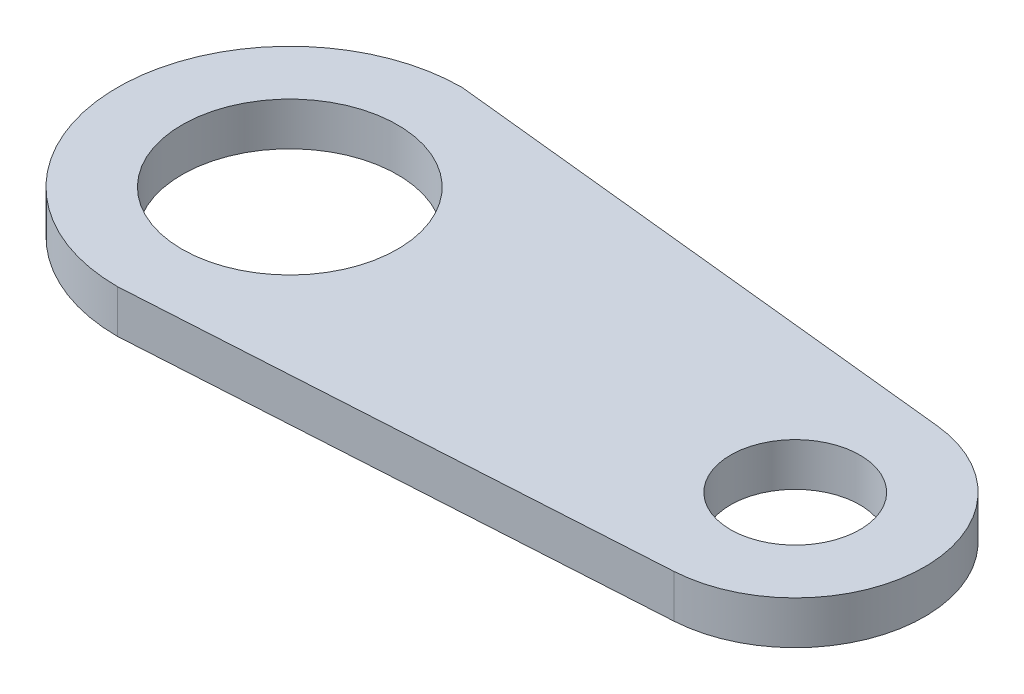
from build123d import *

# Parameters (mm, degrees)
BOSS_EXTRUDE1_DEPTH = 5
SKETCH2_R           = 12.5
SKETCH2_R_2         = 7.5
CUT_EXTRUDE1_DEPTH  = 10


with BuildPart() as part:
    # Sketch1 → Boss-Extrude1 (new body)
    with BuildSketch(Plane(origin=(0, 0, 0), x_dir=(1, 0, 0), z_dir=(0, 1, 0))):
        with BuildLine():
            Line((61.545103008, 13.562628278), (0, 20))
            ThreePointArc((0, 20), (-20, 0), (0, -20))
            Line((0, -20), (2.403061157, -19.855107582))
            Line((2.403061157, -19.855107582), (60.887460049, -16.328794499))
            ThreePointArc((60.887460049, -16.328794499), (74.981046517, -1.685922519), (61.545103008, 13.562628278))
        make_face()
    extrude(amount=BOSS_EXTRUDE1_DEPTH)

    # Sketch2 → Cut-Extrude1 (cut)
    with BuildSketch(Plane(origin=(0, 5, 0), x_dir=(1, 0, 0), z_dir=(0, 1, 0))):
        with Locations(Location((0, 0, 0), (0, 0, 270))):
            Circle(SKETCH2_R)
        with Locations(Location((59.984675549, -1.355986475, 0), (0, 0, 270))):
            Circle(SKETCH2_R_2)
    extrude(amount=-CUT_EXTRUDE1_DEPTH, mode=Mode.SUBTRACT)


solid = part.part
